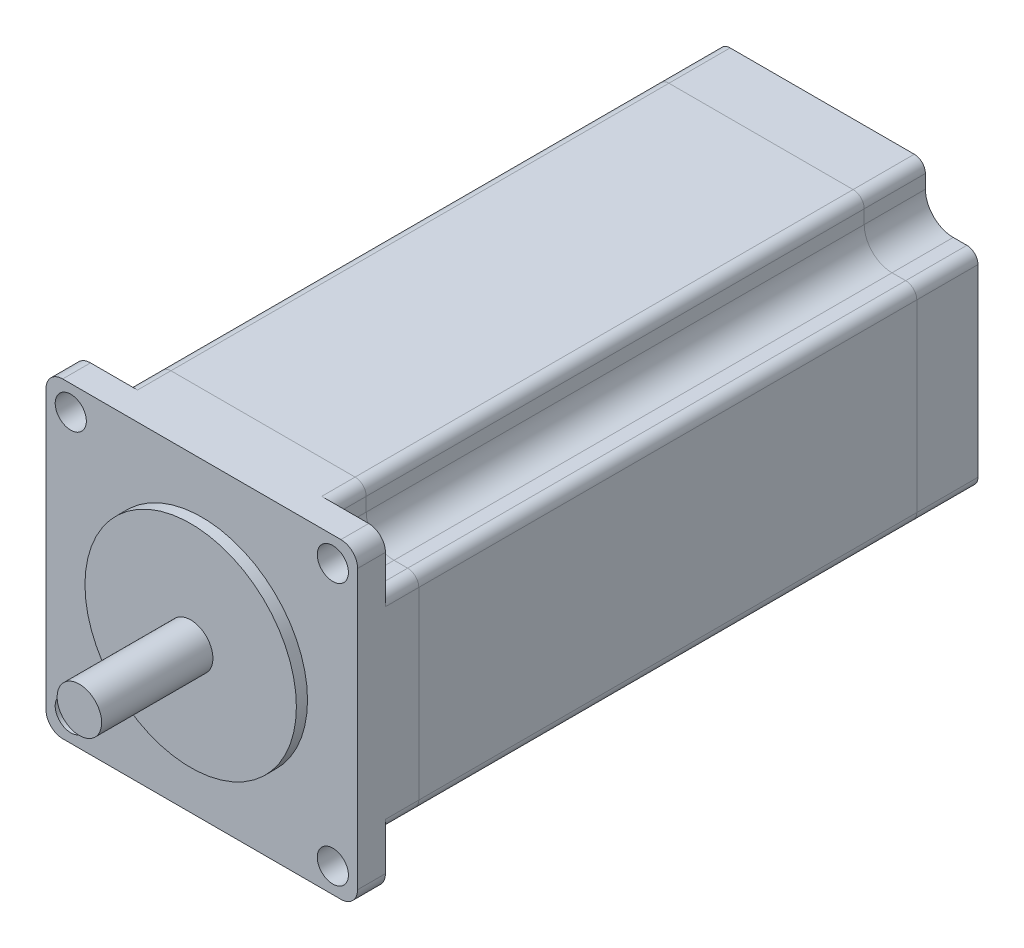
from build123d import *

# Parameters (mm, degrees)
BOSS_EXTRUDE1_DEPTH     = 11.5
BOSS_EXTRUDE2_DEPTH     = 90
SKETCH3_W               = 56
SKETCH3_H               = 56
BOSS_EXTRUDE3_DEPTH     = 10
SKETCH4_W               = 10
SKETCH4_H               = 0.6
SKETCH5_W               = 10
SKETCH5_H               = 0.6
SKETCH6_W               = 10
SKETCH6_H               = 0.6
SKETCH7_W               = 10
SKETCH7_H               = 0.6
HOLE1_D                 = 5.6
HOLE1_DEPTH             = 5
HOLE2_D                 = 5.6
HOLE2_DEPTH             = 5
CUT_EXTRUDE9_DEPTH      = 110.759965379
CUT_EXTRUDE9_DEPTH_BACK = 5
FILLET3_R               = 2
FILLET4_R               = 3
SKETCH17_R              = 4
BOSS_EXTRUDE4_DEPTH     = 12


with BuildPart() as part:
    # Sketch1 → Boss-Extrude1 (new body)
    with BuildSketch(Plane(origin=(0, 0, 0), x_dir=(-1, 0, 0), z_dir=(0, 0, -1))):
        Polygon((-23, 28), (-28, 23), (-28, -23), (-23, -28), (23, -28), (28, -23), (28, 23), (23, 28), align=None)
    extrude(amount=-BOSS_EXTRUDE1_DEPTH)

    # Sketch2 → Boss-Extrude2 (add)
    with BuildSketch(Plane.XY.offset(11.5)):
        Polygon((23, 28), (-23, 28), (-28, 23), (-28, -23), (-23, -28), (23, -28), (28, -23), (28, 23), align=None)
    extrude(amount=BOSS_EXTRUDE2_DEPTH)

    # Sketch3 → Boss-Extrude3 (add)
    with BuildSketch(Plane.XY.offset(101.5)):
        Rectangle(SKETCH3_W, SKETCH3_H)
    extrude(amount=BOSS_EXTRUDE3_DEPTH)

    # Sketch4 → Revolve1 (revolve)
    with BuildSketch(Plane.XY.offset(3.65)):
        with Locations((-26, 0.95)):
            Rectangle(SKETCH4_W, SKETCH4_H)
    revolve(axis=Axis((-31, 0.65, 3.65), (1, 0, 0)))

    # Sketch5 → Revolve2 (revolve)
    with BuildSketch(Plane.XY.offset(3.65)):
        with Locations((-26, -0.35)):
            Rectangle(SKETCH5_W, SKETCH5_H)
    revolve(axis=Axis((-31, -0.65, 3.65), (1, 0, 0)))

    # Sketch6 → Revolve3 (revolve)
    with BuildSketch(Plane.XY.offset(4.95)):
        with Locations((-26, -0.35)):
            Rectangle(SKETCH6_W, SKETCH6_H)
    revolve(axis=Axis((-31, -0.65, 4.95), (1, 0, 0)))

    # Sketch7 → Revolve4 (revolve)
    with BuildSketch(Plane.XY.offset(4.95)):
        with Locations((-26, 0.95)):
            Rectangle(SKETCH7_W, SKETCH7_H)
    revolve(axis=Axis((-31, 0.65, 4.95), (1, 0, 0)))

    # Sketch8 → Revolve5 (revolve)
    with BuildSketch(Plane.XZ, mode=Mode.PRIVATE) as revolve5_sk:
        Polygon((4, 133.5), (0, 133.5), (0, 111.5), (19, 111.5), (19, 113.5), (4, 113.5), align=None)
    revolve(revolve5_sk.sketch.rotate(Axis((0, 0, 133.5), (0, 0, -1)), 180), axis=Axis((0, 0, 133.5), (0, 0, -1)))

    # Hole1
    with Locations(Plane.XY.offset(111.5)):
        with Locations((-23.55, 23.55)):
            hole1 = Hole(HOLE1_D / 2, depth=HOLE1_DEPTH)

    # Hole2
    with Locations(Plane.XY.offset(111.5)):
        with Locations((-23.55, -23.55), (-23.55, 23.55)):
            hole2 = Hole(HOLE2_D / 2, depth=HOLE2_DEPTH)

    # Mirror2: Hole1, Hole2 across plane
    add(hole1.mirror(Plane(origin=(0, 0, 0), x_dir=(0, 0, 1), z_dir=(1, 0, 0))), mode=Mode.SUBTRACT)
    add(hole2.mirror(Plane(origin=(0, 0, 0), x_dir=(0, 0, 1), z_dir=(1, 0, 0))), mode=Mode.SUBTRACT)

    # Sketch34 → Cut-Extrude9 (cut, two sides: drawn at the far end of the back side and taken through both)
    with BuildSketch(Plane(origin=(0, 0, 101.5), x_dir=(-1, 0, 0), z_dir=(0, 0, -1)).offset(-CUT_EXTRUDE9_DEPTH_BACK)):
        with BuildLine():
            Line((18.55, 23.55), (18.55, 34.67124832))
            Line((18.55, 34.67124832), (31.974713938, 34.67124832))
            Line((31.974713938, 34.67124832), (31.974713938, 18.55))
            Line((31.974713938, 18.55), (23.55, 18.55))
            ThreePointArc((23.55, 18.55), (20.014466094, 20.014466094), (18.55, 23.55))
        make_face()
        with BuildLine():
            Line((23.55, -18.55), (31.974713938, -18.55))
            Line((31.974713938, -18.55), (31.974713938, -34.67124832))
            Line((31.974713938, -34.67124832), (18.55, -34.67124832))
            Line((18.55, -34.67124832), (18.55, -23.55))
            ThreePointArc((18.55, -23.55), (20.014466094, -20.014466094), (23.55, -18.55))
        make_face()
        with BuildLine():
            Line((-18.55, -23.55), (-18.55, -34.67124832))
            Line((-18.55, -34.67124832), (-31.974713938, -34.67124832))
            Line((-31.974713938, -34.67124832), (-31.974713938, -18.55))
            Line((-31.974713938, -18.55), (-23.55, -18.55))
            ThreePointArc((-23.55, -18.55), (-20.014466094, -20.014466094), (-18.55, -23.55))
        make_face()
        with BuildLine():
            Line((-23.55, 18.55), (-31.974713938, 18.55))
            Line((-31.974713938, 18.55), (-31.974713938, 34.67124832))
            Line((-31.974713938, 34.67124832), (-18.55, 34.67124832))
            Line((-18.55, 34.67124832), (-18.55, 23.55))
            ThreePointArc((-18.55, 23.55), (-20.014466094, 20.014466094), (-23.55, 18.55))
        make_face()
    extrude(amount=CUT_EXTRUDE9_DEPTH + CUT_EXTRUDE9_DEPTH_BACK, mode=Mode.SUBTRACT)

    # Fillet3
    fillet3_edges = [part.edges().sort_by_distance(p)[0] for p in [
        (18.55, 28, 53.25),
        (28, 18.55, 53.25),
        (28, -18.55, 53.25),
        (18.55, -28, 53.25),
        (-18.55, -28, 53.25),
        (-28, -18.55, 53.25),
        (-28, 18.55, 53.25),
        (-18.55, 28, 53.25),
    ]]
    fillet(fillet3_edges, radius=FILLET3_R)

    # Fillet4
    fillet4_edges = [part.edges().sort_by_distance(p)[0] for p in [
        (28, -28, 109),
        (28, 28, 109),
        (-28, 28, 109),
        (-28, -28, 109),
    ]]
    fillet(fillet4_edges, radius=FILLET4_R)

    # Sketch17 → Boss-Extrude4 (add)
    with BuildSketch(Plane(origin=(0, 0, 0), x_dir=(-1, 0, 0), z_dir=(0, 0, -1))):
        Circle(SKETCH17_R)
    extrude(amount=BOSS_EXTRUDE4_DEPTH)


solid = part.part
